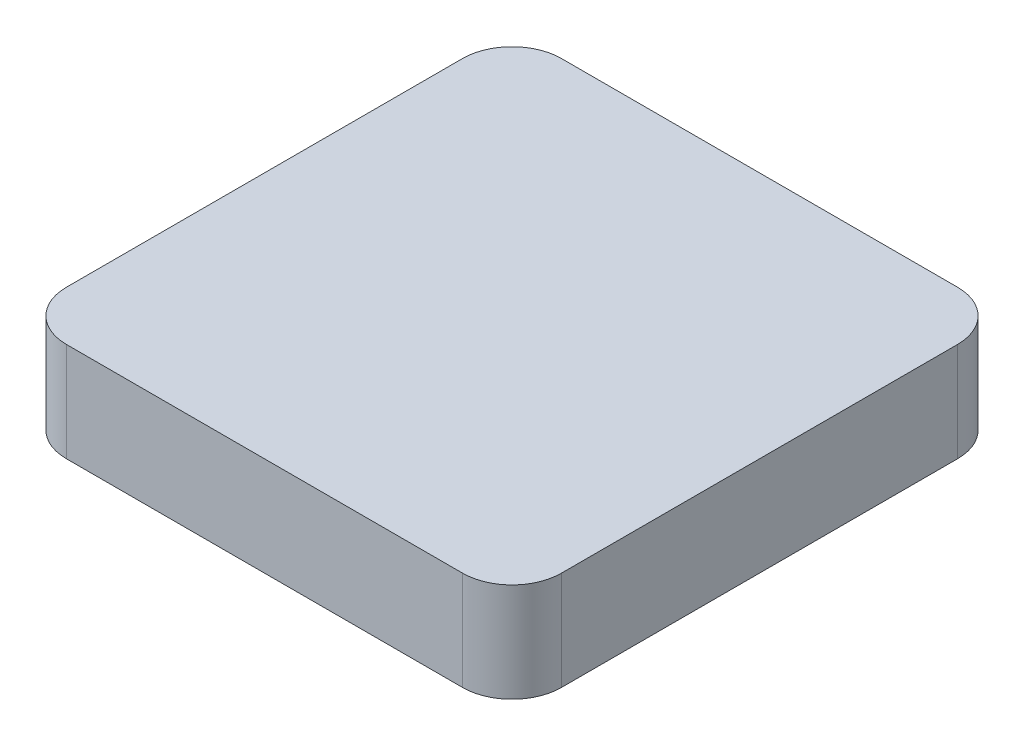
from build123d import *

# Parameters (mm, degrees)
SKETCH1_W           = 100
SKETCH1_H           = 100
BOSS_EXTRUDE1_DEPTH = 20
FILLET1_R           = 10


with BuildPart() as part:
    # Sketch1 → Boss-Extrude1 (new body)
    with BuildSketch(Plane(origin=(0, 0, 0), x_dir=(1, 0, 0), z_dir=(0, 1, 0))):
        Rectangle(SKETCH1_W, SKETCH1_H)
    extrude(amount=BOSS_EXTRUDE1_DEPTH)

    # Fillet1
    fillet1_edges = [part.edges().sort_by_distance(p)[0] for p in [
        (-50, 10, 50),
        (50, 10, 50),
        (50, 10, -50),
        (-50, 10, -50),
    ]]
    fillet(fillet1_edges, radius=FILLET1_R)


solid = part.part
